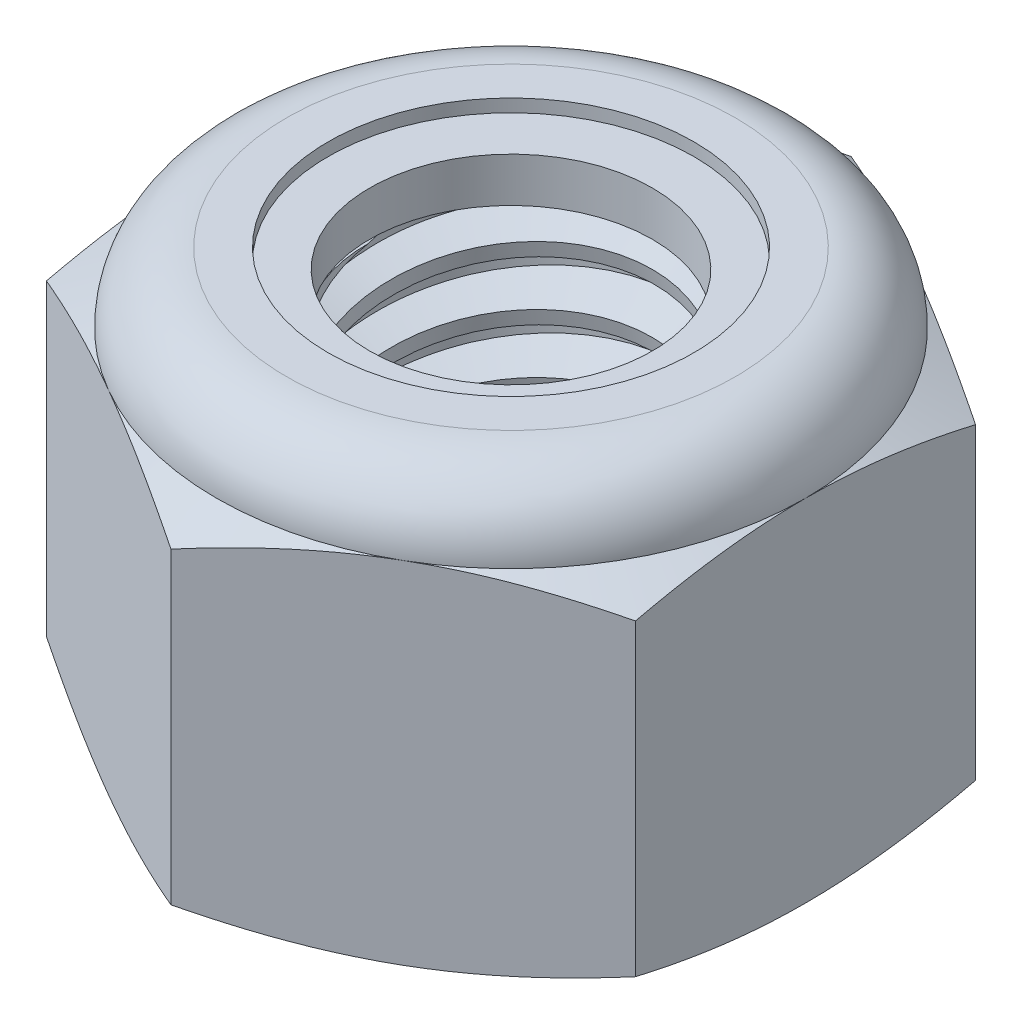
from build123d import *

# Parameters (mm, degrees)
EXTRUDE1_DEPTH      = 5
SKETCH2_W           = 2
SKETCH2_H           = 5
LPATTERN1_COUNT     = 7
LPATTERN1_PITCH     = 0.7
LPATTERN1_COL_COUNT = 2
LPATTERN1_COL_PITCH = 0.7


with BuildPart() as part:
    # Sketch1 → Extrude1 (new body)
    with BuildSketch(Plane(origin=(0, 0, 0), x_dir=(1, 0, 0), z_dir=(0, 1, 0))):
        Polygon((0, 4.041451884), (-3.5, 2.020725942), (-3.5, -2.020725942), (0, -4.041451884), (3.5, -2.020725942), (3.5, 2.020725942), align=None)
    extrude(amount=EXTRUDE1_DEPTH)

    # Sketch4 → Cut-Revolve2 (revolve, cut)
    with BuildSketch(Plane(origin=(0, 0, 0), x_dir=(0, 0, -1), z_dir=(1, 0, 0)), mode=Mode.PRIVATE) as cut_revolve2_sk:
        Polygon((0, 5), (2, 5), (1.679577111, 4.850584353), (1.679577111, 0.149415647), (2, 0), (0, 0), align=None)
    revolve(cut_revolve2_sk.sketch.rotate(Axis((0, 5, 0), (0, 1, 0)), 54.612382926), axis=Axis((0, 5, 0), (0, 1, 0)), mode=Mode.SUBTRACT)


with BuildPart() as body_2:
    # Sketch2 → Revolve1 (revolve)
    with BuildSketch(Plane(origin=(0, 0, 0), x_dir=(0, 0, -1), z_dir=(1, 0, 0))):
        with Locations((1, 2.5)):
            Rectangle(SKETCH2_W, SKETCH2_H)
    revolve(axis=Axis((0, -2, 0), (0, 1, 0)))

    # Sketch3 → Cut-Revolve1 (revolve, cut)
    with BuildSketch(Plane(origin=(0, 0, 0), x_dir=(0, 0, -1), z_dir=(1, 0, 0)), mode=Mode.PRIVATE) as cut_revolve1_sk:
        Polygon((2.015083279, 4.913809834), (2.120666232, 4.310478673), (1.709743669, 4.460641574), (1.679577111, 4.633021905), align=None)
    cut_revolve1 = revolve(cut_revolve1_sk.sketch.rotate(Axis((0, 5, 0.13120342), (0, -0.9850304671557042, -0.1723803317522489)), 180), axis=Axis((0, 5, 0.13120342), (0, -0.9850304671557042, -0.1723803317522489)), mode=Mode.SUBTRACT)

    # LPattern1: Cut-Revolve1 ×7
    with Locations(*[(0, -i * LPATTERN1_PITCH, 0) for i in range(1, LPATTERN1_COUNT)]):
        add(cut_revolve1, mode=Mode.SUBTRACT)

    # LPattern1 col: Cut-Revolve1 ×2
    with Locations(*[(0, i * LPATTERN1_COL_PITCH, 0) for i in range(1, LPATTERN1_COL_COUNT)]):
        add(cut_revolve1, mode=Mode.SUBTRACT)


with BuildPart() as part_1:
    add(part.part)

    # Combine1: cut body 2
    add(body_2.part, mode=Mode.SUBTRACT)

    # Sketch5 → Cut-Revolve3 (revolve, cut)
    with BuildSketch(Plane(origin=(0, 0, 0), x_dir=(0, 0, -1), z_dir=(1, 0, 0)), mode=Mode.PRIVATE) as cut_revolve3_sk:
        with BuildLine():
            Line((0, 0), (3.5, 0))
            Line((3.5, 0), (4.041451884, 0.25248316))
            Line((4.041451884, 0.25248316), (4.041451884, 3.914183506))
            Line((4.041451884, 3.914183506), (3.5, 4.166666667))
            ThreePointArc((3.5, 4.166666667), (3.255922318, 4.755922318), (2.666666667, 5))
            Line((2.666666667, 5), (2.666666667, 6.27))
            Line((2.666666667, 6.27), (5.311451884, 6.27))
            Line((5.311451884, 6.27), (5.311451884, -1.27))
            Line((5.311451884, -1.27), (0, -1.27))
            Line((0, -1.27), (0, 0))
        make_face()
    revolve(cut_revolve3_sk.sketch.rotate(Axis((0, 0, 0), (0, 1, 0)), 54.612382926), axis=Axis((0, 0, 0), (0, 1, 0)), mode=Mode.SUBTRACT)

    # Sketch6 → Cut-Revolve4 (revolve, cut)
    with BuildSketch(Plane(origin=(0, 0, 0), x_dir=(0, 0, -1), z_dir=(1, 0, 0)), mode=Mode.PRIVATE) as cut_revolve4_sk:
        with BuildLine():
            Line((0, 4.166666667), (3.3476, 4.166666667))
            ThreePointArc((3.3476, 4.166666667), (3.148159244, 4.648159244), (2.666666667, 4.8476))
            Line((2.666666667, 4.8476), (2.173121889, 4.8476))
            Line((2.173121889, 4.8476), (2.173121889, 6.27))
            Line((2.173121889, 6.27), (0, 6.27))
            Line((0, 6.27), (0, 4.166666667))
        make_face()
    revolve(cut_revolve4_sk.sketch.rotate(Axis((0, 6.27, 0), (0, 1, 0)), 54.612382926), axis=Axis((0, 6.27, 0), (0, 1, 0)), mode=Mode.SUBTRACT)


with BuildPart() as body_2_2:
    # Sketch7 → Revolve2 (revolve)
    with BuildSketch(Plane(origin=(0, 0, 0), x_dir=(0, 0, -1), z_dir=(1, 0, 0))):
        with BuildLine():
            Line((1.679577111, 4.242866667), (3.266579964, 4.242866667))
            ThreePointArc((3.266579964, 4.242866667), (3.066430175, 4.620419399), (2.666666667, 4.7714))
            Line((2.666666667, 4.7714), (1.679577111, 4.7714))
            Line((1.679577111, 4.7714), (1.679577111, 4.242866667))
        make_face()
    revolve(axis=Axis((0, 4.242866667, 0), (0, 1, 0)))


solid = Compound([part_1.part, body_2_2.part])
